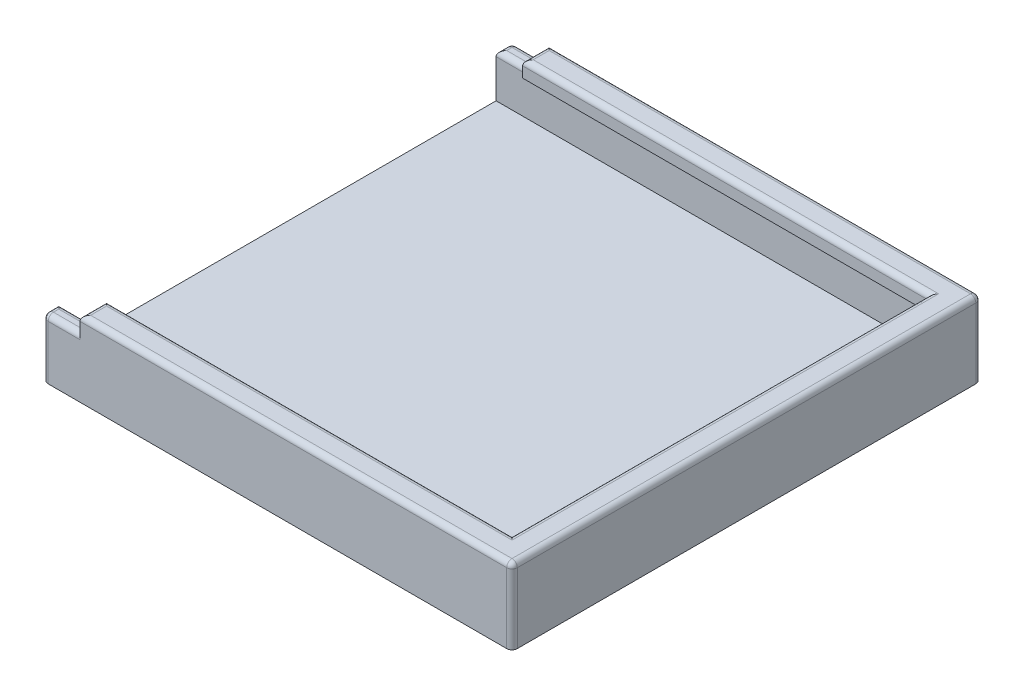
from build123d import *

# Parameters (mm, degrees)
SKETCH2_W           = 44.2
SKETCH2_H           = 44.2
BOSS_EXTRUDE1_DEPTH = 1.5
SKETCH2_3_W         = 44.2
SKETCH2_3_H         = 44.2
SKETCH2_3_W_2       = 41.2
SKETCH2_3_H_2       = 41.2
BOSS_EXTRUDE2_DEPTH = 4.1
SKETCH3_W           = 2.5
SKETCH3_H           = 44.2
BOSS_EXTRUDE3_DEPTH = 1.5
BOSS_EXTRUDE5_DEPTH = 38.2
SKETCH5_W           = 6.546498532
SKETCH5_H           = 41.2
CUT_EXTRUDE1_DEPTH  = 4.1
FILLET2_R           = 0.5


with BuildPart() as part:
    # Sketch2 → Boss-Extrude1 (new body)
    with BuildSketch(Plane(origin=(0, 0, 0), x_dir=(1, 0, 0), z_dir=(0, 1, 0))):
        Rectangle(SKETCH2_W, SKETCH2_H)
    extrude(amount=-BOSS_EXTRUDE1_DEPTH)

    # Sketch2<3> → Boss-Extrude2 (add)
    with BuildSketch(Plane(origin=(0, 0, 0), x_dir=(1, 0, 0), z_dir=(0, 1, 0))):
        Rectangle(SKETCH2_3_W, SKETCH2_3_H)
        Rectangle(SKETCH2_3_W_2, SKETCH2_3_H_2, mode=Mode.SUBTRACT)
    extrude(amount=BOSS_EXTRUDE2_DEPTH)

    # Sketch3 → Boss-Extrude3 (add)
    with BuildSketch(Plane(origin=(0, 4.1, 0), x_dir=(1, 0, 0), z_dir=(0, 1, 0))):
        with Locations((20.85, 0)):
            Rectangle(SKETCH3_W, SKETCH3_H)
    extrude(amount=BOSS_EXTRUDE3_DEPTH)

    # Sketch6 → Boss-Extrude5 (add)
    with BuildSketch(Plane.ZY.offset(-19.6)):
        Polygon((-19.6, 5.6), (-19.6, 4.1), (-20.6, 4.1), (-22.1, 4.1), (-22.1, 5.6), align=None)
        Polygon((19.6, 5.6), (19.6, 4.1), (20.6, 4.1), (22.1, 4.1), (22.1, 5.6), align=None)
    extrude(amount=BOSS_EXTRUDE5_DEPTH)

    # Sketch5 → Cut-Extrude1 (cut)
    with BuildSketch(Plane(origin=(0, 4.1, 0), x_dir=(1, 0, 0), z_dir=(0, 1, 0))):
        with Locations((-23.873249266, 0)):
            Rectangle(SKETCH5_W, SKETCH5_H)
    extrude(amount=-CUT_EXTRUDE1_DEPTH, mode=Mode.SUBTRACT)

    # Fillet2
    fillet2_edges = [part.edges().sort_by_distance(p)[0] for p in [
        (-22.1, 4.1, -21.35),
        (-20.35, 4.1, 22.1),
        (-20.35, 4.1, 20.6),
        (22.1, 5.6, 0),
        (1.75, 5.6, -22.1),
        (1.75, 5.6, 22.1),
        (19.6, 5.6, 0),
        (-20.35, 4.1, -20.6),
        (-20.35, 4.1, -22.1),
        (-18.6, 5.6, -20.85),
        (0.5, 5.6, -19.6),
        (0.5, 5.6, 19.6),
        (-18.6, 5.6, 20.85),
        (-22.1, 1.3, -22.1),
        (-22.1, 1.3, 22.1),
        (22.1, 2.05, 22.1),
        (22.1, 2.05, -22.1),
        (-22.1, 4.1, 21.35),
    ]]
    fillet(fillet2_edges, radius=FILLET2_R)


solid = part.part
